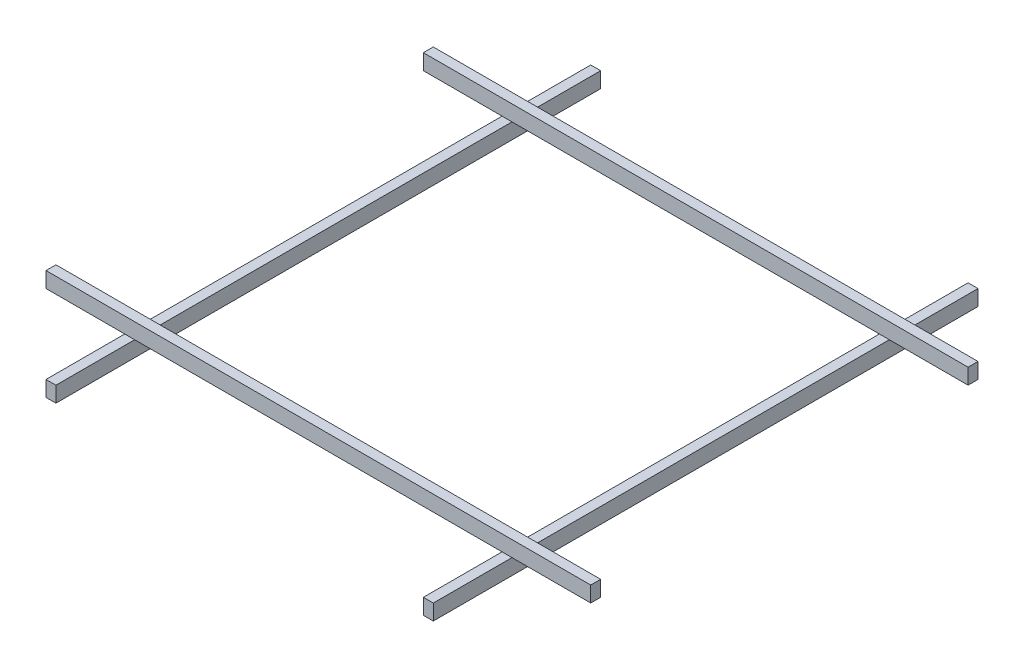
from build123d import *

# Parameters (mm, degrees)
SKETCH1_W              = 88.9
SKETCH1_H              = 139.7
PROFILES_4X6_1_DEPTH   = 4876.8
SKETCH1_ON_SEGMENT_2_W = 88.9
SKETCH1_ON_SEGMENT_2_H = 139.7
PROFILES_4X6_1_2_DEPTH = 4876.8
SKETCH1_ON_SEGMENT_3_W = 88.9
SKETCH1_ON_SEGMENT_3_H = 139.7
PROFILES_4X6_1_3_DEPTH = 4876.8
SKETCH1_ON_SEGMENT_4_W = 88.9
SKETCH1_ON_SEGMENT_4_H = 139.7
PROFILES_4X6_1_4_DEPTH = 4876.8


with BuildPart() as part:
    # Sketch1 → Profiles 4X6(1) (new body)
    with BuildSketch(Plane(origin=(444.5, 0, 0), x_dir=(-1, 0, 0), z_dir=(0, 0, -1))):
        Rectangle(SKETCH1_W, SKETCH1_H)
    extrude(amount=PROFILES_4X6_1_DEPTH)


with BuildPart() as body_2:
    # Sketch1 on segment 2 (carried to segment 2) → Profiles 4X6_1 2 (new body)
    with BuildSketch(Plane(origin=(3822.7, 0, 0), x_dir=(-1, 0, 0), z_dir=(0, 0, -1))):
        Rectangle(SKETCH1_ON_SEGMENT_2_W, SKETCH1_ON_SEGMENT_2_H)
    extrude(amount=PROFILES_4X6_1_2_DEPTH)


with BuildPart() as body_3:
    # Sketch1 on segment 3 (carried to segment 3) → Profiles 4X6_1 3 (new body)
    with BuildSketch(Plane(origin=(-304.8, 139.7, -4127.5), x_dir=(0, 0, -1), z_dir=(1, 0, 0))):
        Rectangle(SKETCH1_ON_SEGMENT_3_W, SKETCH1_ON_SEGMENT_3_H)
    extrude(amount=PROFILES_4X6_1_3_DEPTH)


with BuildPart() as body_4:
    # Sketch1 on segment 4 (carried to segment 4) → Profiles 4X6_1 4 (new body)
    with BuildSketch(Plane(origin=(4572, 139.7, -749.3), x_dir=(0, 0, 1), z_dir=(-1, 0, 0))):
        Rectangle(SKETCH1_ON_SEGMENT_4_W, SKETCH1_ON_SEGMENT_4_H)
    extrude(amount=PROFILES_4X6_1_4_DEPTH)


solid = Compound([part.part, body_2.part, body_3.part, body_4.part])
